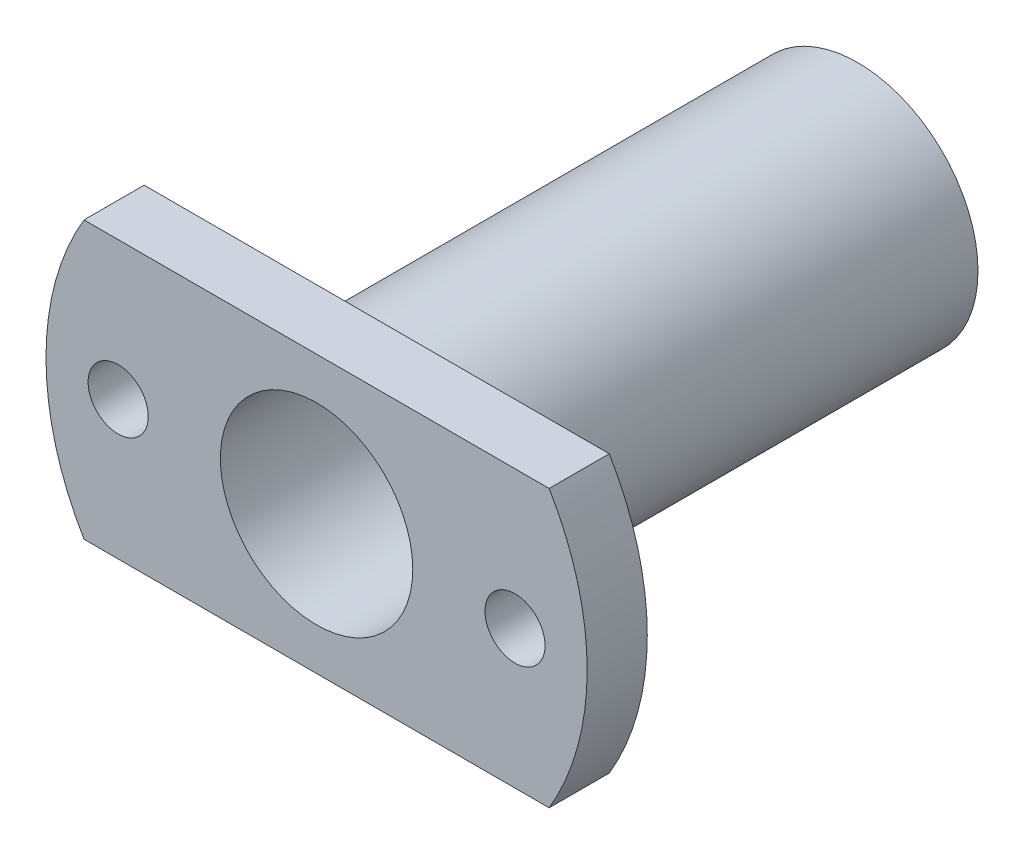
from build123d import *

# Parameters (mm, degrees)
SKETCH1_R           = 2.5
BOSS_EXTRUDE1_DEPTH = 5
SKETCH2_R           = 10
BOSS_EXTRUDE2_DEPTH = 40
CUT_EXTRUDE1_REACH  = 53.609
SKETCH3_R           = 8


with BuildPart() as part:
    # Sketch1 → Boss-Extrude1 (new body)
    with BuildSketch(Plane.XY):
        with BuildLine():
            Line((-19.339079606, -11.5), (19.339079606, -11.5))
            ThreePointArc((19.339079606, -11.5), (22.5, 0), (19.339079606, 11.5))
            Line((19.339079606, 11.5), (-19.339079606, 11.5))
            ThreePointArc((-19.339079606, 11.5), (-22.5, 0), (-19.339079606, -11.5))
        make_face()
        with Locations((-16.5, 0)):
            Circle(SKETCH1_R, mode=Mode.SUBTRACT)
        with Locations((16.5, 0)):
            Circle(SKETCH1_R, mode=Mode.SUBTRACT)
    extrude(amount=BOSS_EXTRUDE1_DEPTH)

    # Sketch2 → Boss-Extrude2 (add)
    with BuildSketch(Plane(origin=(0, 0, 0), x_dir=(-1, 0, 0), z_dir=(0, 0, -1))):
        with Locations(Location((0, 0, 0), (0, 0, 180))):
            Circle(SKETCH2_R)
    extrude(amount=BOSS_EXTRUDE2_DEPTH)

    # Sketch3 → Cut-Extrude1 (cut, up to next)
    with BuildSketch(Plane.XY.offset(5), mode=Mode.PRIVATE) as cut_extrude1_sk1:
        Circle(SKETCH3_R)
    cut_extrude1_tool1 = extrude(cut_extrude1_sk1.sketch, amount=-CUT_EXTRUDE1_REACH, mode=Mode.PRIVATE) & part.part
    add(cut_extrude1_tool1.solids().sort_by_distance((0, 0, 5))[0], mode=Mode.SUBTRACT)


solid = part.part
